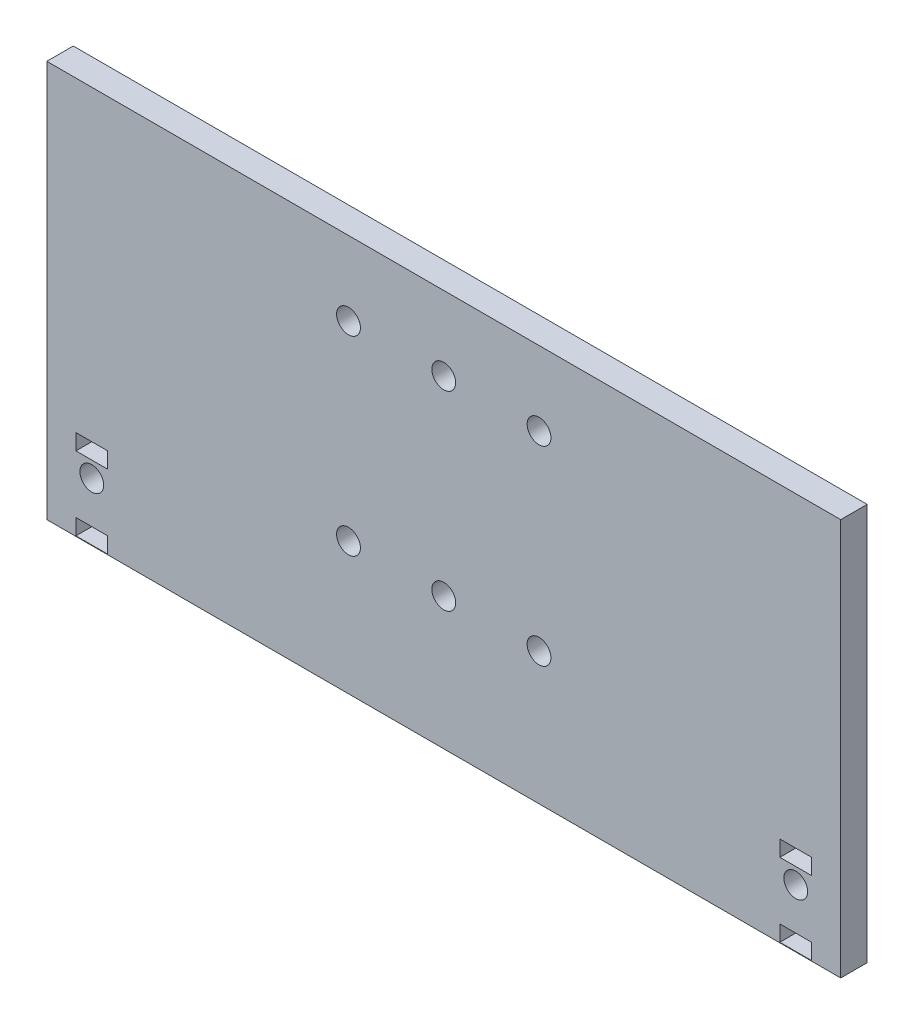
from build123d import *

# Parameters (mm, degrees)
ESQUISSE1_W        = 150
ESQUISSE1_H        = 75
ESQUISSE1_R        = 2.25
ESQUISSE1_W_2      = 6
ESQUISSE1_H_2      = 3
BOSS_EXTRU_1_DEPTH = 5


with BuildPart() as part:
    # Esquisse1 → Boss.-Extru.1 (new body)
    with BuildSketch(Plane.XY):
        with Locations((75, -37.5)):
            Rectangle(ESQUISSE1_W, ESQUISSE1_H)
        with Locations((8.5, -64)):
            Circle(ESQUISSE1_R, mode=Mode.SUBTRACT)
        with Locations((141.5, -64)):
            Circle(ESQUISSE1_R, mode=Mode.SUBTRACT)
        with Locations((57, -14)):
            Circle(ESQUISSE1_R, mode=Mode.SUBTRACT)
        with Locations((93, -14)):
            Circle(ESQUISSE1_R, mode=Mode.SUBTRACT)
        with Locations((93, -50)):
            Circle(ESQUISSE1_R, mode=Mode.SUBTRACT)
        with Locations((57, -50)):
            Circle(ESQUISSE1_R, mode=Mode.SUBTRACT)
        with Locations((75, -14)):
            Circle(ESQUISSE1_R, mode=Mode.SUBTRACT)
        with Locations((75, -50)):
            Circle(ESQUISSE1_R, mode=Mode.SUBTRACT)
        with Locations((8.5, -59.5)):
            Rectangle(ESQUISSE1_W_2, ESQUISSE1_H_2, mode=Mode.SUBTRACT)
        with Locations((8.5, -73.4)):
            Rectangle(ESQUISSE1_W_2, ESQUISSE1_H_2, mode=Mode.SUBTRACT)
        with Locations((141.5, -59.5)):
            Rectangle(ESQUISSE1_W_2, ESQUISSE1_H_2, mode=Mode.SUBTRACT)
        with Locations((141.5, -73.4)):
            Rectangle(ESQUISSE1_W_2, ESQUISSE1_H_2, mode=Mode.SUBTRACT)
    extrude(amount=BOSS_EXTRU_1_DEPTH)


solid = part.part
